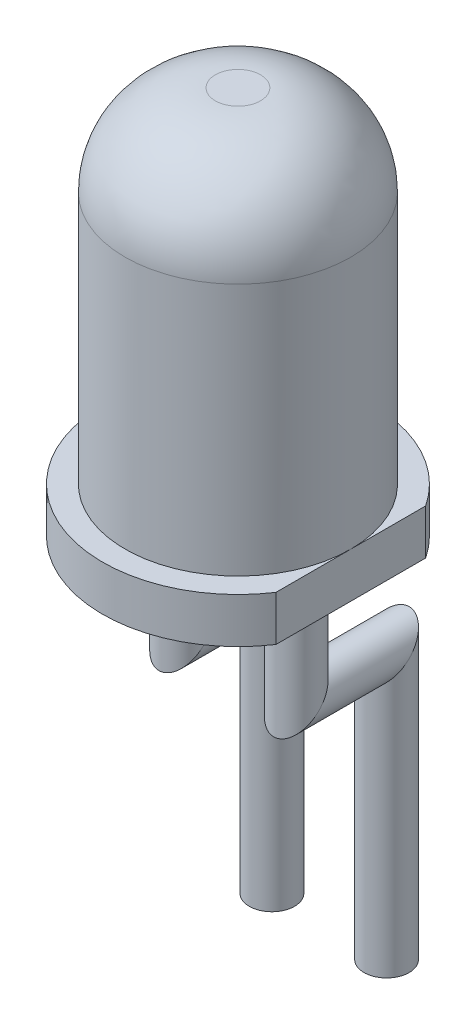
from build123d import *

# Parameters (mm, degrees)
SCHIZZO1_R                   = 3
ESTRUSIONE_ESTRUSIONE1_DEPTH = 1
SCHIZZO2_R                   = 2.5
ESTRUSIONE_ESTRUSIONE2_DEPTH = 7.6
RACCORDO3_R                  = 2
SCHIZZO6_R                   = 0.5
SCHIZZO7_W                   = 4.951519697
SCHIZZO7_H                   = 4.598065652
TAGLIO_ESTRUSIONE1_DEPTH     = 10


with BuildPart() as part:
    # Schizzo1 → Estrusione-Estrusione1 (new body)
    with BuildSketch(Plane(origin=(0, 0, 0), x_dir=(1, 0, 0), z_dir=(0, 1, 0))):
        with Locations(Location((0, 0, 0), (0, 0, 270))):
            Circle(SCHIZZO1_R)
    extrude(amount=ESTRUSIONE_ESTRUSIONE1_DEPTH)

    # Schizzo2 → Estrusione-Estrusione2 (add)
    with BuildSketch(Plane(origin=(0, 1, 0), x_dir=(1, 0, 0), z_dir=(0, 1, 0))):
        with Locations(Location((0, 0, 0), (0, 0, 90))):
            Circle(SCHIZZO2_R)
    extrude(amount=ESTRUSIONE_ESTRUSIONE2_DEPTH)

    # Raccordo3
    raccordo3_edges = [part.edges().sort_by_distance(p)[0] for p in [
        (0, 8.6, 2.5),
    ]]
    fillet(raccordo3_edges, radius=RACCORDO3_R)

    # Sweep1: sweep along a path in Schizzo5
    with BuildLine(Plane(origin=(1.27, 0, 0), x_dir=(0, 0, -1), z_dir=(1, 0, 0))) as sweep1_path:
        Line((0, 0), (0, -2.5))
        Line((0, -2.5), (2, -2.5))
        Line((2, -2.5), (2, -8.5))
    # Schizzo6 → Sweep1 (sweep)
    with BuildSketch(Plane.XZ):
        with Locations((1.27, -0.022402078)):
            Circle(SCHIZZO6_R)
    sweep1 = sweep(path=sweep1_path.line, transition=Transition.RIGHT)

    # Specchia1: Sweep1 across plane
    add(sweep1.mirror(Plane(origin=(0, 0, 0), x_dir=(0, 0, 1), z_dir=(1, 0, 0))))

    # Schizzo7 → Taglio-Estrusione1 (cut)
    with BuildSketch(Plane(origin=(2.5, 0, 0), x_dir=(0, 0, -1), z_dir=(1, 0, 0))):
        with Locations((0.024240151, 0.648217725)):
            Rectangle(SCHIZZO7_W, SCHIZZO7_H)
    extrude(amount=TAGLIO_ESTRUSIONE1_DEPTH, mode=Mode.SUBTRACT)


solid = part.part
